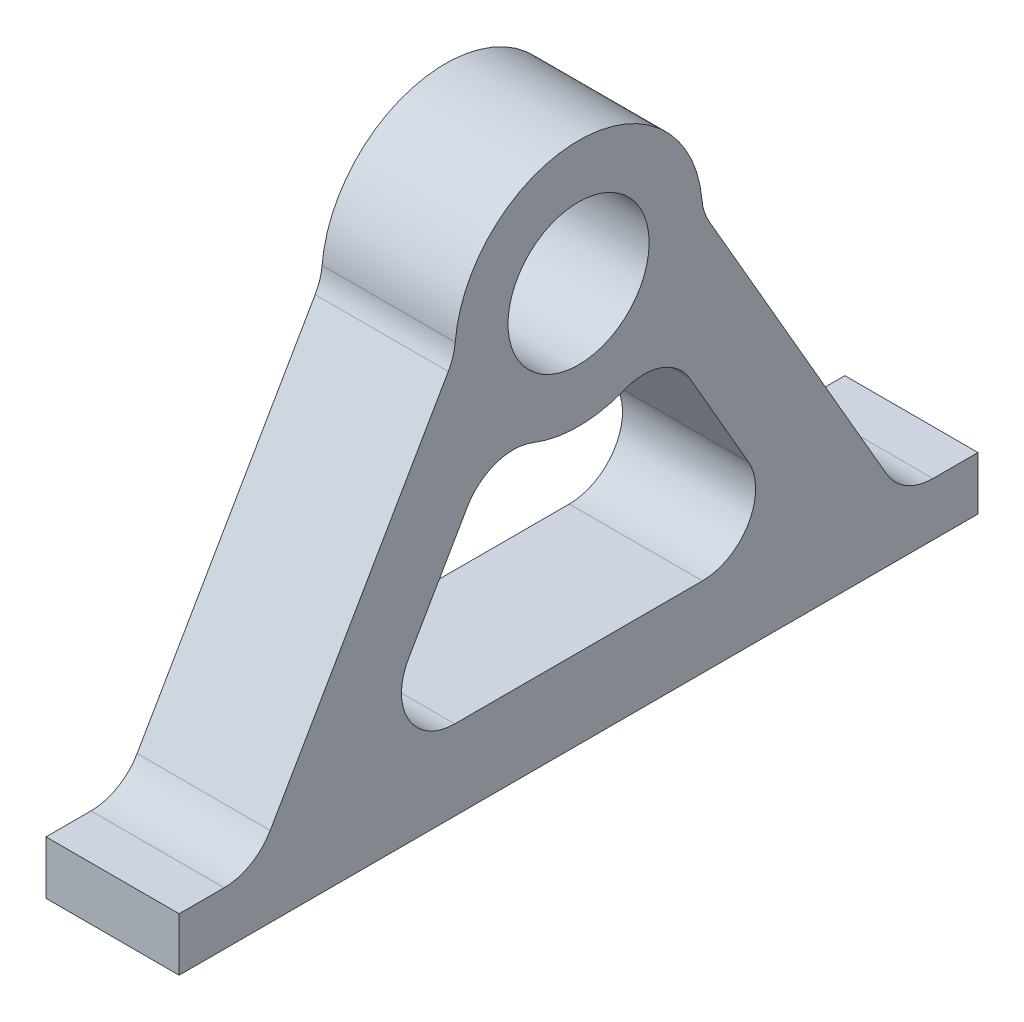
from build123d import *

# Parameters (mm, degrees)
SKETCH_1_R      = 2.65
EXTRUDE_1_DEPTH = 2.5
FILLET_1_R      = 2


with BuildPart() as part:
    # 草图1 → 凸台-拉伸1 (new, symmetric)
    with BuildSketch(Plane(origin=(0, 0, 0), x_dir=(0, 0, -1), z_dir=(1, 0, 0))):
        with BuildLine():
            Line((-4.65, 0), (-12.155553499, -13))
            Line((-12.155553499, -13), (-15, -13))
            Line((-15, -13), (-15, -15))
            Line((-15, -15), (15, -15))
            Line((15, -15), (15, -13))
            Line((15, -13), (12.155553499, -13))
            Line((12.155553499, -13), (4.65, 0))
            ThreePointArc((4.65, 0), (0, 4.65), (-4.65, 0))
        make_face()
        Circle(SKETCH_1_R, mode=Mode.SUBTRACT)
        with BuildLine():
            Line((-8.114101615, -12), (8.114101615, -12))
            Line((8.114101615, -12), (3.157006961, -3.4140602))
            ThreePointArc((3.157006961, -3.4140602), (0, -4.65), (-3.157006961, -3.4140602))
            Line((-3.157006961, -3.4140602), (-8.114101615, -12))
        make_face(mode=Mode.SUBTRACT)
    extrude(amount=EXTRUDE_1_DEPTH, both=True)

    # 圆角1
    fillet_1_edges = [part.edges().sort_by_distance(p)[0] for p in [
        (0, 0, -4.65),
        (0, -13, -12.155553499),
        (0, -13, 12.155553499),
        (0, 0, 4.65),
        (0, -3.4140602, 3.157006961),
        (0, -12, 8.114101615),
        (0, -12, -8.114101615),
        (0, -3.4140602, -3.157006961),
    ]]
    fillet(fillet_1_edges, radius=FILLET_1_R)


solid = part.part
